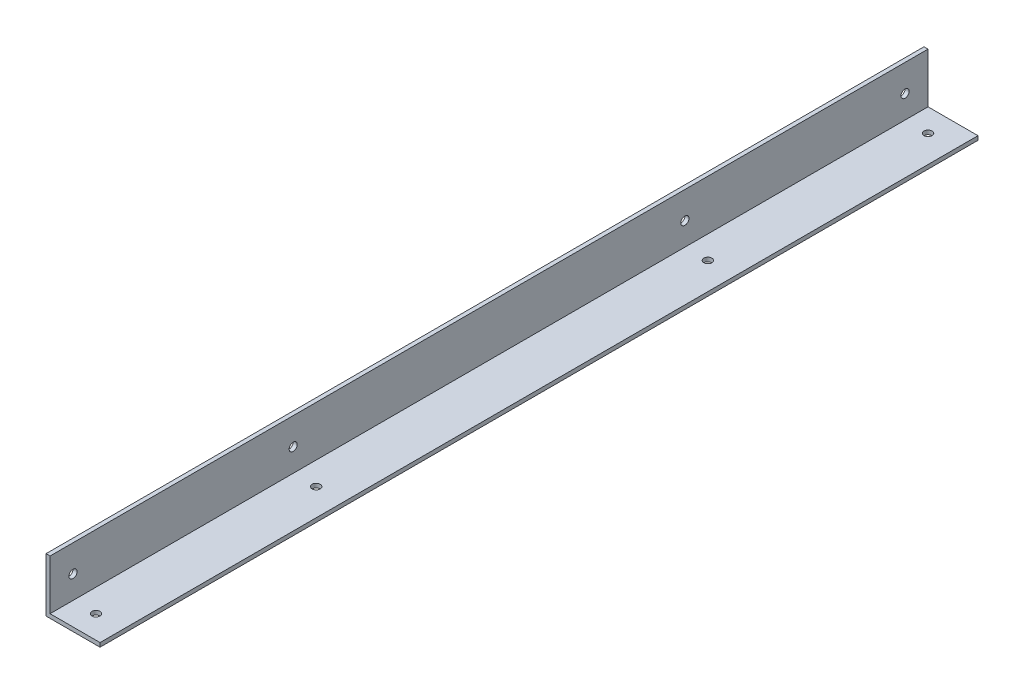
from build123d import *

# Parameters (mm, degrees)
EXTRUSION1_DEPTH = 325
ESQUISSE2_R      = 1.5
EXTRUSION2_DEPTH = 300
ESQUISSE3_R      = 1.5
EXTRUSION3_DEPTH = 300


with BuildPart() as part:
    # Esquisse1 → Extrusion1 (new body)
    with BuildSketch(Plane.XY):
        Polygon((-17.43168638, 4.773368421), (-17.43168638, -15.226631579), (2.56831362, -15.226631579), (2.56831362, -13.726631579), (-15.93168638, -13.726631579), (-15.93168638, 4.773368421), align=None)
    extrude(amount=EXTRUSION1_DEPTH)

    # Esquisse2 → Extrusion2 (cut)
    with BuildSketch(Plane(origin=(0, -13.726631579, 0), x_dir=(-1, 0, 0), z_dir=(0, 1, 0))):
        with Locations((7.43168638, 8.5)):
            Circle(ESQUISSE2_R)
        with Locations((7.43168638, 316.5)):
            Circle(ESQUISSE2_R)
        with Locations((7.43168638, 235)):
            Circle(ESQUISSE2_R)
        with Locations((7.43168638, 90)):
            Circle(ESQUISSE2_R)
    extrude(amount=-EXTRUSION2_DEPTH, mode=Mode.SUBTRACT)

    # Esquisse3 → Extrusion3 (cut)
    with BuildSketch(Plane(origin=(-15.93168638, 0, 0), x_dir=(0, 0, -1), z_dir=(1, 0, 0))):
        with Locations((-316.5, -5.226631579)):
            Circle(ESQUISSE3_R)
        with Locations((-8.5, -5.226631579)):
            Circle(ESQUISSE3_R)
        with Locations((-235, -5.226631579)):
            Circle(ESQUISSE3_R)
        with Locations((-90, -5.226631579)):
            Circle(ESQUISSE3_R)
    extrude(amount=-EXTRUSION3_DEPTH, mode=Mode.SUBTRACT)


solid = part.part
